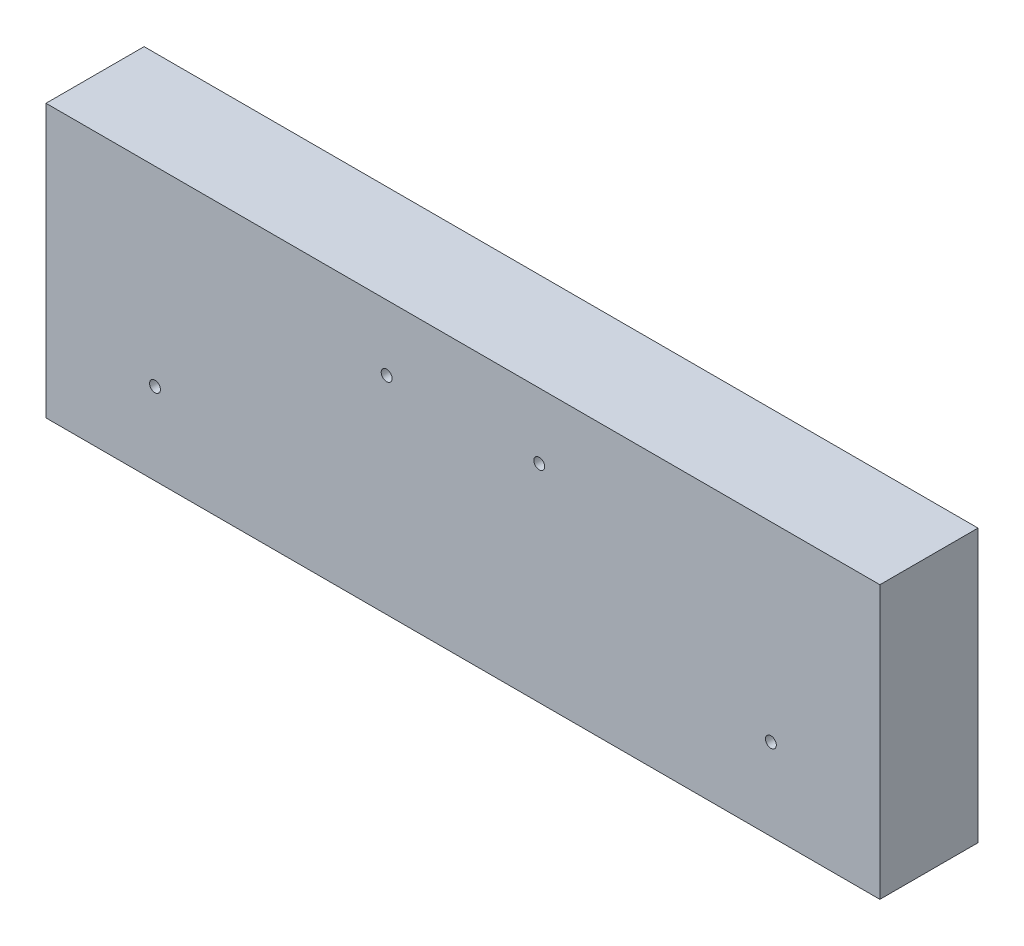
from build123d import *

# Parameters (mm, degrees)
SKETCH1_W           = 153
SKETCH1_H           = 50
SKETCH1_R           = 1
BOSS_EXTRUDE1_DEPTH = 18


with BuildPart() as part:
    # Sketch1 → Boss-Extrude1 (new body)
    with BuildSketch(Plane.XY):
        Rectangle(SKETCH1_W, SKETCH1_H)
        with Locations((-14, 13)):
            Circle(SKETCH1_R, mode=Mode.SUBTRACT)
        with Locations(Location((14, 13, 0), (0, 0, 180))):
            Circle(SKETCH1_R, mode=Mode.SUBTRACT)
        with Locations((-56.5, -10)):
            Circle(SKETCH1_R, mode=Mode.SUBTRACT)
        with Locations((56.5, -10)):
            Circle(SKETCH1_R, mode=Mode.SUBTRACT)
    extrude(amount=BOSS_EXTRUDE1_DEPTH)


solid = part.part
